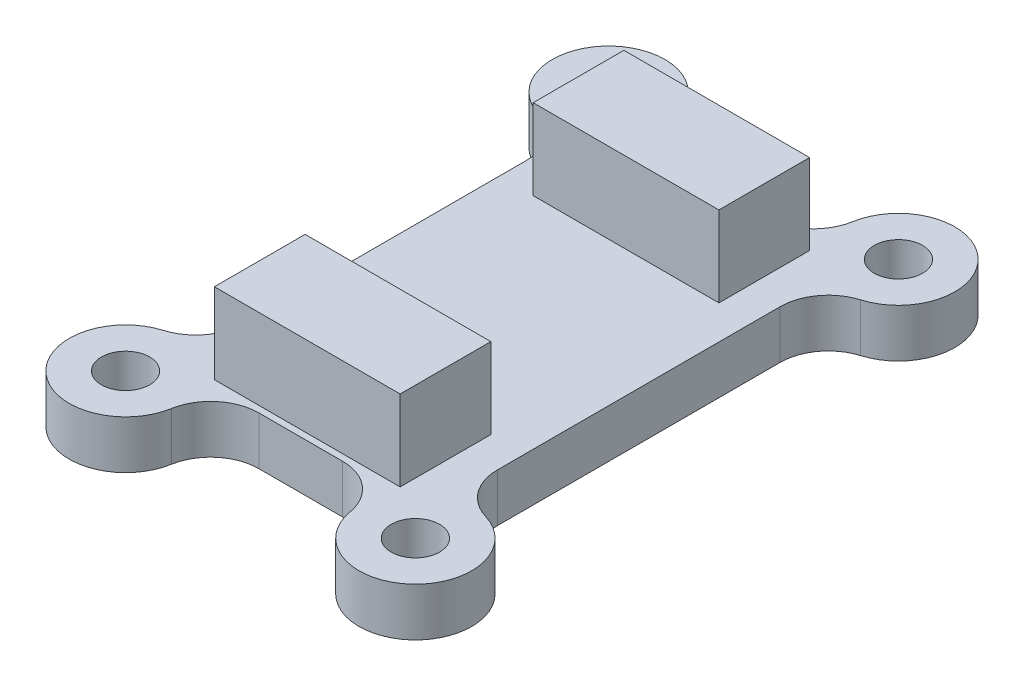
from build123d import *

# Parameters (mm, degrees)
SKETCH1_R           = 3.5
SKETCH1_R_2         = 1.5
SKETCH1_W           = 15.74389133
SKETCH1_H           = 26.239818884
BOSS_EXTRUDE1_DEPTH = 3
FILLET1_R           = 3
SKETCH2_W           = 11.534893024
SKETCH2_H           = 5.633319849
BOSS_EXTRUDE2_DEPTH = 5


with BuildPart() as part:
    # Sketch1 → Boss-Extrude1 (new body)
    # profile 1 of 5: a face of its own
    with BuildSketch(Plane(origin=(0, 0, 0), x_dir=(1, 0, 0), z_dir=(0, 1, 0))):
        with Locations((9, 15)):
            Circle(SKETCH1_R)
        with Locations(Location((9, 15, 0), (0, 0, 270))):
            Circle(SKETCH1_R_2, mode=Mode.SUBTRACT)
    # profile 2 of 5: a face of its own
    with BuildSketch(Plane(origin=(0, 0, 0), x_dir=(1, 0, 0), z_dir=(0, 1, 0))):
        with Locations((9, -15)):
            Circle(SKETCH1_R)
        with Locations(Location((9, -15, 0), (0, 0, 270))):
            Circle(SKETCH1_R_2, mode=Mode.SUBTRACT)
    # profile 3 of 5: a face of its own
    with BuildSketch(Plane(origin=(0, 0, 0), x_dir=(1, 0, 0), z_dir=(0, 1, 0))):
        with Locations((-9, -15)):
            Circle(SKETCH1_R)
        with Locations(Location((-9, -15, 0), (0, 0, 270))):
            Circle(SKETCH1_R_2, mode=Mode.SUBTRACT)
    # profile 4 of 5: a face of its own
    with BuildSketch(Plane(origin=(0, 0, 0), x_dir=(1, 0, 0), z_dir=(0, 1, 0))):
        with Locations((-9, 15)):
            Circle(SKETCH1_R)
        with Locations(Location((-9, 15, 0), (0, 0, 270))):
            Circle(SKETCH1_R_2, mode=Mode.SUBTRACT)
    # profile 5 of 5: a face of its own
    with BuildSketch(Plane(origin=(0, 0, 0), x_dir=(1, 0, 0), z_dir=(0, 1, 0))):
        Rectangle(SKETCH1_W, SKETCH1_H)
    extrude(amount=BOSS_EXTRUDE1_DEPTH)

    # Fillet1
    fillet1_edges = [part.edges().sort_by_distance(p)[0] for p in [
        (-6.047838166, 1.5, -13.119909442),
        (6.047838166, 1.5, -13.119909442),
        (7.871945665, 1.5, -11.686769942),
        (7.871945665, 1.5, 11.686769942),
        (6.047838166, 1.5, 13.119909442),
        (-6.047838166, 1.5, 13.119909442),
        (-7.871945665, 1.5, 11.686769942),
        (-7.871945665, 1.5, -11.686769942),
    ]]
    fillet(fillet1_edges, radius=FILLET1_R)

    # Sketch2 → Boss-Extrude2 (add)
    with BuildSketch(Plane(origin=(0, 3, 0), x_dir=(1, 0, 0), z_dir=(0, 1, 0))):
        with Locations((0, 9.898547735)):
            Rectangle(SKETCH2_W, SKETCH2_H)
        with Locations((0, -9.898547735)):
            Rectangle(SKETCH2_W, SKETCH2_H)
    extrude(amount=BOSS_EXTRUDE2_DEPTH)


solid = part.part
